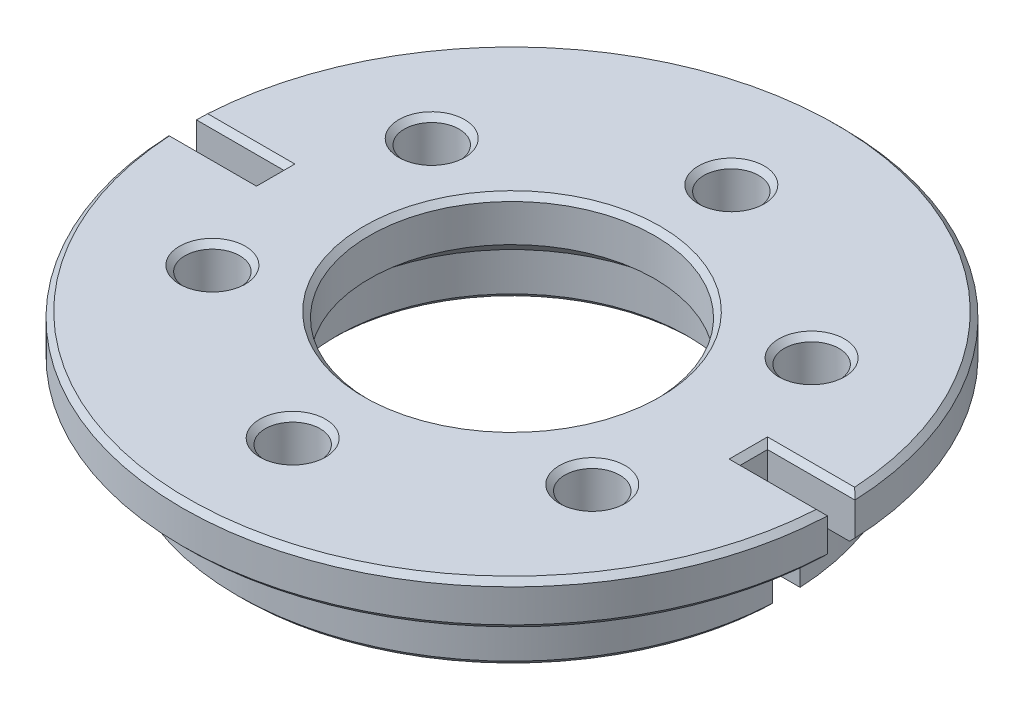
from build123d import *

# Parameters (mm, degrees)
SKETCH2_R               = 2.5
CUT_EXTRUDE1_DEPTH      = 44.751171413
SKETCH3_W               = 8
SKETCH3_H               = 2.5
CUT_EXTRUDE_THIN1_DEPTH = 44.751171413
CHAMFER1_SIZE           = 0.5


with BuildPart() as part:
    # Sketch1 → Revolve1 (revolve)
    with BuildSketch(Plane.XY, mode=Mode.PRIVATE) as revolve1_sk:
        Polygon((-15.975, 0), (-25.05, 0), (-25.05, 6.4), (-30.05, 6.4), (-30.05, 10.4), (-13, 10.4), (-13, 6.496321403), (-15.975, 4), align=None)
    revolve(revolve1_sk.sketch.rotate(Axis((0, 0, 0), (0, 1, 0)), 270), axis=Axis((0, 0, 0), (0, 1, 0)))

    # Sketch2 → Cut-Extrude1 (cut, through all)
    with BuildSketch(Plane(origin=(0, 10.4, 0), x_dir=(1, 0, 0), z_dir=(0, 1, 0))):
        with Locations(Location((0, 20, 0), (0, 0, 270))):
            Circle(SKETCH2_R)
        with Locations(Location((17.320508076, 10, 0), (0, 0, 270))):
            Circle(SKETCH2_R)
        with Locations(Location((17.320508076, -10, 0), (0, 0, 270))):
            Circle(SKETCH2_R)
        with Locations(Location((0, -20, 0), (0, 0, 270))):
            Circle(SKETCH2_R)
        with Locations(Location((-17.320508076, -10, 0), (0, 0, 270))):
            Circle(SKETCH2_R)
        with Locations(Location((-17.320508076, 10, 0), (0, 0, 270))):
            Circle(SKETCH2_R)
    extrude(amount=-CUT_EXTRUDE1_DEPTH, mode=Mode.SUBTRACT)

    # Sketch3 → Cut-Extrude-Thin1 (cut, through all)
    with BuildSketch(Plane(origin=(0, 10.4, 0), x_dir=(1, 0, 0), z_dir=(0, 1, 0))):
        with Locations((-26.05, 0)):
            Rectangle(SKETCH3_W, SKETCH3_H)
        with Locations((26.05, 0)):
            Rectangle(SKETCH3_W, SKETCH3_H)
    extrude(amount=-CUT_EXTRUDE_THIN1_DEPTH, mode=Mode.SUBTRACT)

    # Chamfer1
    chamfer1_edges = [part.edges().sort_by_distance(p)[0] for p in [
        (0, 0, 15.975),
        (0, 0, -22.5),
        (0, 10.4, -22.5),
        (-17.320508076, 0, -12.5),
        (-17.320508076, 10.4, -12.5),
        (-17.320508076, 0, 7.5),
        (-17.320508076, 10.4, 7.5),
        (0, 0, 17.5),
        (0, 10.4, 17.5),
        (17.320508076, 0, 7.5),
        (17.320508076, 10.4, 7.5),
        (17.320508076, 0, -12.5),
        (17.320508076, 10.4, -12.5),
        (0, 10.4, 30.05),
        (0, 10.4, -30.05),
        (26.036995204, 10.4, 1.25),
        (26.036995204, 10.4, -1.25),
        (-26.036995204, 10.4, -1.25),
        (-26.036995204, 10.4, 1.25),
        (0, 6.4, 30.05),
        (0, 6.4, -30.05),
        (0, 0, 25.05),
        (0, 0, -25.05),
        (-23.534396468, 0, -1.25),
        (-22.05, 0, 0),
        (-23.534396468, 0, 1.25),
        (-22.05, 10.4, 0),
        (0, 10.4, 13),
        (23.534396468, 0, 1.25),
        (22.05, 0, 0),
        (23.534396468, 0, -1.25),
        (22.05, 10.4, 0),
    ]]
    chamfer(chamfer1_edges, length=CHAMFER1_SIZE)


solid = part.part
